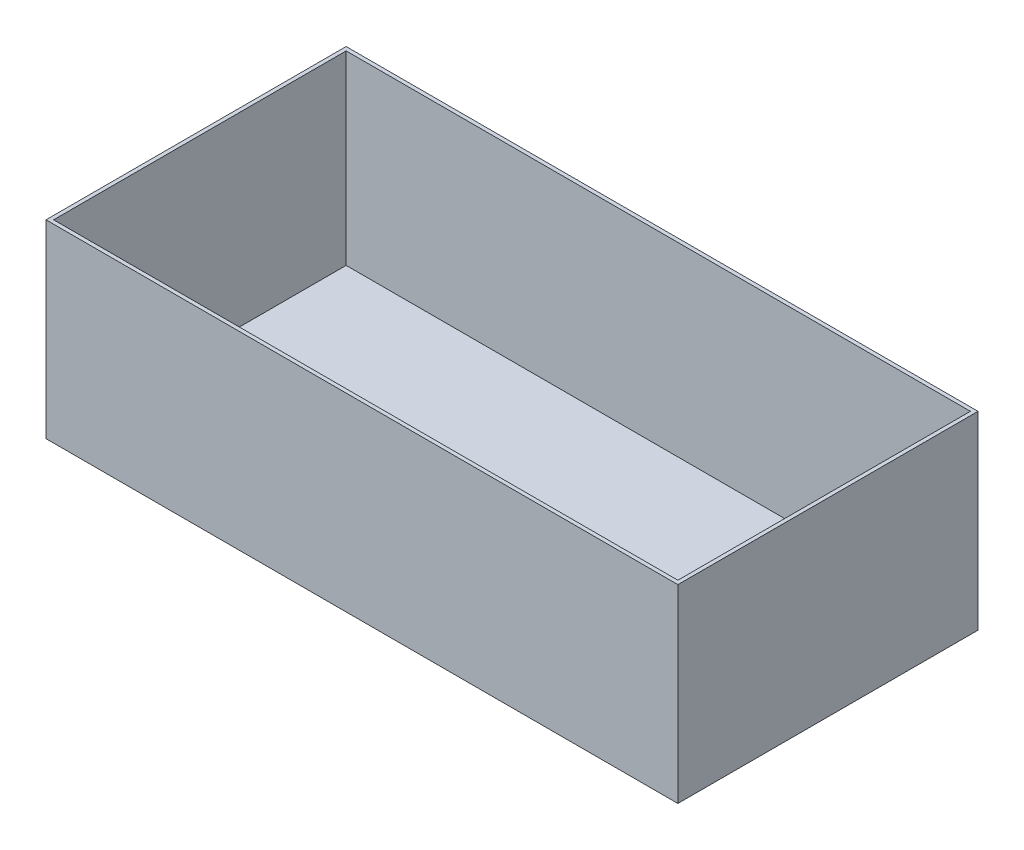
from build123d import *

# Parameters (mm, degrees)
SKETCH1_W           = 200
SKETCH1_H           = 95
BOSS_EXTRUDE1_DEPTH = 60
SKETCH2_W           = 197.6
SKETCH2_H           = 92.6
CUT_EXTRUDE1_DEPTH  = 58.8


with BuildPart() as part:
    # Sketch1 → Boss-Extrude1 (new body)
    with BuildSketch(Plane(origin=(0, 0, 0), x_dir=(1, 0, 0), z_dir=(0, 1, 0))):
        with Locations((100, 47.5)):
            Rectangle(SKETCH1_W, SKETCH1_H)
    extrude(amount=BOSS_EXTRUDE1_DEPTH)

    # Sketch2 → Cut-Extrude1 (cut)
    with BuildSketch(Plane(origin=(0, 60, 0), x_dir=(1, 0, 0), z_dir=(0, 1, 0))):
        with Locations((100, 47.5)):
            Rectangle(SKETCH2_W, SKETCH2_H)
    extrude(amount=-CUT_EXTRUDE1_DEPTH, mode=Mode.SUBTRACT)


solid = part.part
